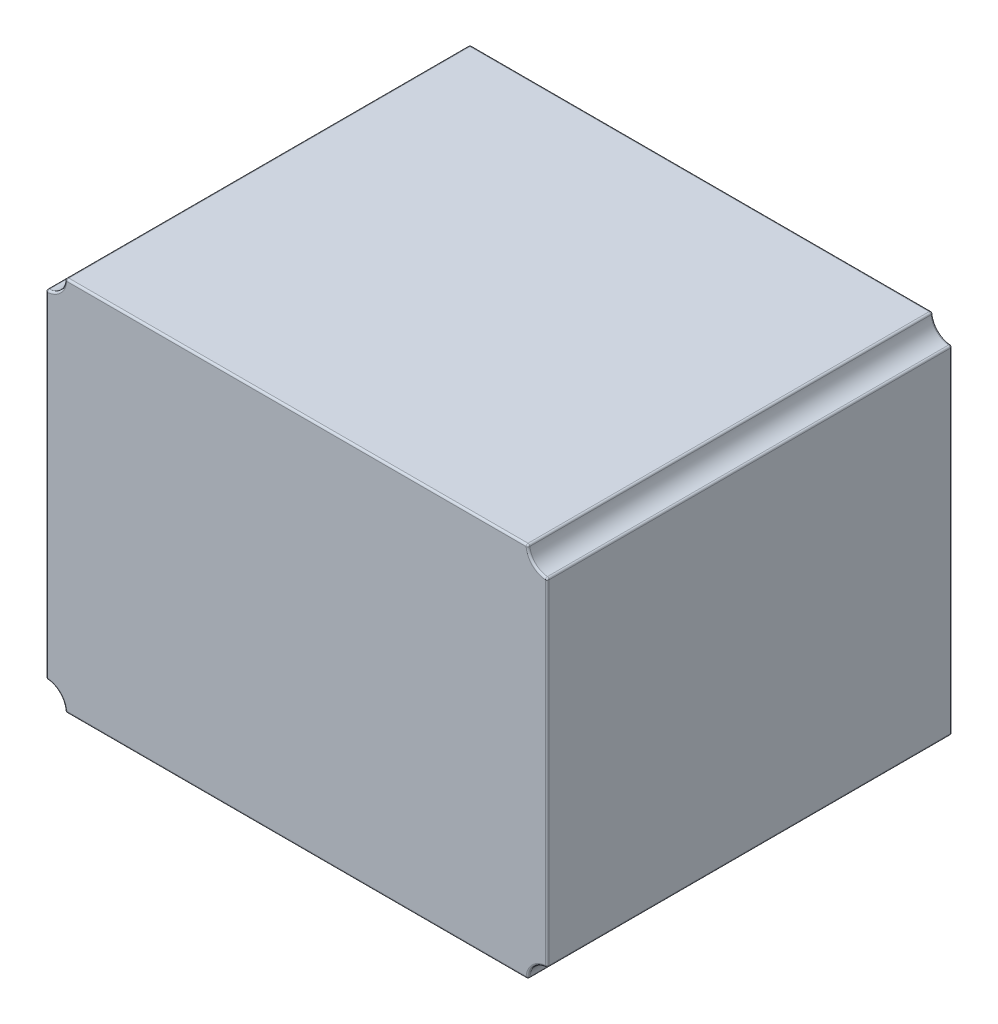
from build123d import *

# Parameters (mm, degrees)
SKETCH1_W           = 260
SKETCH1_H           = 195
BOSS_EXTRUDE1_DEPTH = 210
SKETCH2_R           = 10
CUT_EXTRUDE1_DEPTH  = 210
FILLET1_R           = 1
SKETCH4_W           = 19.05
SKETCH4_H           = 1.709615385
CUT_EXTRUDE2_DEPTH  = 60


with BuildPart() as part:
    # Sketch1 → Boss-Extrude1 (new body)
    with BuildSketch(Plane.XY):
        with Locations((130, -97.5)):
            Rectangle(SKETCH1_W, SKETCH1_H)
    extrude(amount=-BOSS_EXTRUDE1_DEPTH)

    # Sketch2 → Cut-Extrude1 (cut)
    with BuildSketch(Plane.XY):
        Circle(SKETCH2_R)
        with Locations((260, 0)):
            Circle(SKETCH2_R)
        with Locations((0, -195)):
            Circle(SKETCH2_R)
        with Locations((260, -195)):
            Circle(SKETCH2_R)
    extrude(amount=-CUT_EXTRUDE1_DEPTH, mode=Mode.SUBTRACT)

    # Fillet1
    fillet1_edges = [part.edges().sort_by_distance(p)[0] for p in [
        (0, -97.5, 0),
        (130, -195, 0),
        (260, -97.5, 0),
        (130, 0, 0),
        (7.071067812, -7.071067812, 0),
        (0, -97.5, -210),
        (130, 0, -210),
        (260, -97.5, -210),
        (130, -195, -210),
        (250, 0, -105),
        (260, -10, -105),
        (252.928932188, -7.071067812, -210),
        (252.928932188, -7.071067812, 0),
        (0, -185, -105),
        (10, -195, -105),
        (7.071067812, -187.928932188, -210),
        (7.071067812, -187.928932188, 0),
        (260, -185, -105),
        (250, -195, -105),
        (252.928932188, -187.928932188, -210),
        (252.928932188, -187.928932188, 0),
        (0, -10, -105),
        (10, 0, -105),
        (7.071067812, -7.071067812, -210),
    ]]
    fillet(fillet1_edges, radius=FILLET1_R)

    # Sketch4 → Cut-Extrude2 (cut)
    # profile 1 of 15: a face of its own
    with BuildSketch(Plane.ZY):
        Polygon((-47.45, -143.5375), (-66.5, -152.329807692), (-66.5, -150.471364183), (-60.394230769, -147.655078125), (-60.394230769, -139.019230769), (-66.5, -136.12280649), (-66.5, -134.256730769), (-47.45, -143.293269231), align=None)
        Polygon((-51.163070913, -143.396304087), (-58.440384615, -139.946544471), (-58.440384615, -146.754477163), align=None, mode=Mode.SUBTRACT)
    # profile 2 of 15: a face of its own
    with BuildSketch(Plane.ZY):
        with BuildLine():
            Line((-47.45, -119.602884615), (-47.45, -123.415174279))
            add(Edge.make_bspline(
                [(-47.45, -123.415174279), (-47.450846832, -123.669579564), (-47.452472844, -124.158065893), (-47.461539354, -124.857871836), (-47.48752549, -125.493745035), (-47.509887923, -126.065353018), (-47.550665489, -126.572685297), (-47.589639868, -127.017297551), (-47.640659365, -127.397142019), (-47.688041738, -127.627080152), (-47.709495192, -127.731189904)],
                knots=[0, 0, 0, 0, 1.410062039, 2.707475311, 3.878576406, 4.937260626, 5.877586885, 6.699081471, 7.410979367, 8, 8, 8, 8], degree=3))
            add(Edge.make_bspline(
                [(-47.709495192, -127.731189904), (-47.743926966, -127.870565556), (-47.81205599, -128.146343599), (-47.956128492, -128.543364771), (-48.122577642, -128.921852704), (-48.31959578, -129.280387043), (-48.543746484, -129.619001049), (-48.796339384, -129.937187723), (-49.078660841, -130.233127902), (-49.383501552, -130.509098702), (-49.713521346, -130.759257351), (-50.063912726, -130.975736931), (-50.432484202, -131.161107308), (-50.820519274, -131.309094055), (-51.224737745, -131.428144856), (-51.648669202, -131.512115361), (-52.090418491, -131.562466128), (-52.391723447, -131.567592807), (-52.544501202, -131.570192308)],
                knots=[0, 0, 0, 0, 1.02737288, 2.032829108, 3.019628684, 3.985738875, 4.958353778, 5.924249254, 6.890702889, 7.883913451, 8.865824512, 9.85161466, 10.829249435, 11.81541824, 12.821369441, 13.843154991, 14.906364023, 16, 16, 16, 16], degree=3))
            add(Edge.make_bspline(
                [(-52.544501202, -131.570192308), (-52.798329706, -131.562196968), (-53.293614861, -131.54659599), (-54.012399293, -131.401132171), (-54.682916054, -131.162873427), (-55.304232016, -130.834503333), (-55.864563384, -130.416530419), (-56.3550561, -129.914222021), (-56.769299546, -129.330143394), (-57.05350706, -128.78385169), (-57.236378356, -128.301057285), (-57.365693198, -127.902424225), (-57.463920314, -127.467252752), (-57.553195038, -127.001786063), (-57.621318824, -126.502428846), (-57.66969966, -125.970186684), (-57.700808906, -125.403728409), (-57.705354099, -125.015436277), (-57.707692308, -124.815685096)],
                knots=[0, 0, 0, 0, 1.260402266, 2.459371274, 3.627181936, 4.786749125, 5.93865593, 7.087644312, 8.261344208, 9.485713728, 10.136162886, 10.825977872, 11.566646758, 12.35154167, 13.181268117, 14.0701832, 15.007234106, 16, 16, 16, 16], degree=3))
            Line((-57.707692308, -124.815685096), (-66.5, -131.814423077))
            Line((-66.5, -131.814423077), (-66.5, -129.700300481))
            Line((-66.5, -129.700300481), (-57.707692308, -122.7015625))
            Line((-57.707692308, -122.7015625), (-57.707692308, -121.3125))
            Line((-57.707692308, -121.3125), (-66.5, -121.3125))
            Line((-66.5, -121.3125), (-66.5, -119.602884615))
            Line((-66.5, -119.602884615), (-47.45, -119.602884615))
        make_face()
        with BuildLine():
            Line((-49.403846154, -121.3125), (-55.753846154, -121.3125))
            Line((-55.753846154, -121.3125), (-55.780558894, -124.800420673))
            add(Edge.make_bspline(
                [(-55.780558894, -124.800420673), (-55.780630939, -124.96327117), (-55.780770582, -125.278921815), (-55.759033036, -125.735581157), (-55.734304379, -126.160777734), (-55.696480164, -126.55288536), (-55.647733283, -126.912078621), (-55.586757897, -127.238179886), (-55.515714591, -127.531715263), (-55.405771799, -127.874078333), (-55.231488036, -128.256262239), (-54.978350799, -128.672129417), (-54.657899182, -129.025072431), (-54.29729158, -129.329377718), (-53.892656588, -129.563770292), (-53.461954432, -129.734366963), (-53.008903502, -129.84142588), (-52.697725324, -129.854153673), (-52.540685096, -129.860576923)],
                knots=[0, 0, 0, 0, 1.14660753, 2.222451964, 3.218720504, 4.145691244, 4.995719623, 5.770487122, 6.480909919, 7.121111896, 8.299844659, 9.430703709, 10.534634535, 11.641396424, 12.741395289, 13.810956493, 14.895269934, 16, 16, 16, 16], degree=3))
            add(Edge.make_bspline(
                [(-52.540685096, -129.860576923), (-52.387444832, -129.854133928), (-52.083778546, -129.841366263), (-51.640439127, -129.734159532), (-51.219015781, -129.561036336), (-50.827541117, -129.318277549), (-50.46922699, -129.024940788), (-50.16688217, -128.676559766), (-49.913686005, -128.290679379), (-49.753066509, -127.929762313), (-49.654395403, -127.60739192), (-49.585047067, -127.327454312), (-49.528861277, -127.009946492), (-49.485177886, -126.655629383), (-49.445867827, -126.265144002), (-49.420380226, -125.837421125), (-49.404975515, -125.372954677), (-49.404231369, -125.051025014), (-49.403846154, -124.884375)],
                knots=[0, 0, 0, 0, 1.100801541, 2.181386982, 3.260112282, 4.364594493, 5.481957178, 6.577424609, 7.668452592, 8.790448866, 9.403819393, 10.091598921, 10.863153553, 11.720938239, 12.658472417, 13.685008818, 14.801622349, 16, 16, 16, 16], degree=3))
            Line((-49.403846154, -124.884375), (-49.403846154, -121.3125))
        make_face(mode=Mode.SUBTRACT)
    # profile 3 of 15: a face of its own
    with BuildSketch(Plane.ZY):
        Polygon((-47.45, -102.506730769), (-47.45, -104.464393029), (-55.635546875, -109.471123798), (-47.45, -114.470222356), (-47.45, -116.427884615), (-57.44438101, -110.322115385), (-66.5, -110.322115385), (-66.5, -108.6125), (-57.44438101, -108.6125), align=None)
    # profile 4 of 15: a face of its own
    with BuildSketch(Plane.ZY):
        Polygon((-47.45, -92.249038462), (-66.5, -101.041346154), (-66.5, -99.182902644), (-60.394230769, -96.366616587), (-60.394230769, -87.730769231), (-66.5, -84.834344952), (-66.5, -82.968269231), (-47.45, -92.004807692), align=None)
        Polygon((-51.163070913, -92.107842548), (-58.440384615, -88.658082933), (-58.440384615, -95.466015625), align=None, mode=Mode.SUBTRACT)
    # profile 5 of 15: a face of its own
    with BuildSketch(Plane.ZY):
        Polygon((-49.403846154, -70.756730769), (-47.45, -70.756730769), (-47.45, -80.770192308), (-64.546153846, -72.779266827), (-64.546153846, -80.525961538), (-66.5, -80.525961538), (-66.5, -70.024038462), (-49.403846154, -78.014963942), align=None)
    # profile 6 of 15: a face of its own
    with BuildSketch(Plane.ZY):
        Polygon((-49.403846154, -58.056730769), (-47.45, -58.056730769), (-47.45, -68.070192308), (-64.546153846, -60.079266827), (-64.546153846, -67.825961538), (-66.5, -67.825961538), (-66.5, -57.324038462), (-49.403846154, -65.314963942), align=None)
    # profile 7 of 15: a face of its own
    with BuildSketch(Plane.ZY):
        Polygon((-47.45, -44.868269231), (-47.45, -55.614423077), (-49.403846154, -55.614423077), (-49.403846154, -46.577884615), (-55.265384615, -46.577884615), (-55.265384615, -55.614423077), (-57.219230769, -55.614423077), (-57.219230769, -46.577884615), (-64.546153846, -46.577884615), (-64.546153846, -55.614423077), (-66.5, -55.614423077), (-66.5, -44.868269231), align=None)
    # profile 8 of 15: a face of its own
    with BuildSketch(Plane.ZY):
        Polygon((-80.932692308, -142.926923077), (-80.932692308, -144.636538462), (-88.748076923, -144.636538462), (-88.748076923, -154.405769231), (-80.932692308, -154.405769231), (-80.932692308, -156.115384615), (-99.982692308, -156.115384615), (-99.982692308, -154.405769231), (-90.701923077, -154.405769231), (-90.701923077, -144.636538462), (-99.982692308, -144.636538462), (-99.982692308, -142.926923077), align=None)
    # profile 9 of 15: a face of its own
    with BuildSketch(Plane.ZY):
        with BuildLine():
            Line((-84.428245192, -139.019230769), (-85.573076923, -137.523317308))
            add(Edge.make_bspline(
                [(-85.573076923, -137.523317308), (-85.445899287, -137.416605258), (-85.193258646, -137.204619869), (-84.838495697, -136.863574781), (-84.506126202, -136.508147268), (-84.194566829, -136.138473194), (-83.914712718, -135.747898557), (-83.651980001, -135.345884782), (-83.416479884, -134.92570685), (-83.130931346, -134.344672409), (-82.832955845, -133.58458912), (-82.583111115, -132.627762925), (-82.42406443, -131.628938231), (-82.40683865, -130.947505582), (-82.398076923, -130.600901442)],
                knots=[0, 0, 0, 0, 0.757959112, 1.505699292, 2.245454638, 2.979532153, 3.711538275, 4.438200793, 5.171680507, 5.909471876, 7.393775596, 8.890124382, 10.418191784, 12, 12, 12, 12], degree=3))
            add(Edge.make_bspline(
                [(-82.398076923, -130.600901442), (-82.400285554, -130.409950377), (-82.404682319, -130.029820452), (-82.462279857, -129.465642363), (-82.544166208, -128.910930677), (-82.662713702, -128.367748169), (-82.817051784, -127.837173354), (-82.998049158, -127.315166342), (-83.223282021, -126.807874985), (-83.472021648, -126.309194161), (-83.753051714, -125.831446514), (-84.059486008, -125.37931938), (-84.388316923, -124.954878316), (-84.738695649, -124.556947185), (-85.114976688, -124.18989016), (-85.512733539, -123.847824607), (-85.9367537, -123.536915352), (-86.379085031, -123.249522342), (-86.840377672, -122.993793964), (-87.317729707, -122.772960128), (-87.809316048, -122.58368717), (-88.31614374, -122.432531674), (-88.836218294, -122.313305891), (-89.370643424, -122.230939302), (-89.918381784, -122.173859906), (-90.289634835, -122.169503587), (-90.476772837, -122.167307692)],
                knots=[0, 0, 0, 0, 1.055000685, 2.100209969, 3.131349012, 4.153242145, 5.170189196, 6.184191144, 7.204341339, 8.235672124, 9.263040994, 10.265373269, 11.252624173, 12.22887325, 13.193405896, 14.155809299, 15.126090485, 16.097288279, 17.069732292, 18.038585918, 19.002221264, 19.978698174, 20.959418239, 21.948869816, 22.966084182, 24, 24, 24, 24], degree=3))
            add(Edge.make_bspline(
                [(-90.476772837, -122.167307692), (-90.758339021, -122.174175593), (-91.311156875, -122.187659805), (-92.120894056, -122.307665738), (-92.896613723, -122.490029163), (-93.633466865, -122.763345375), (-94.340539499, -123.100361921), (-95.005868116, -123.526214393), (-95.639506845, -124.01942726), (-96.226480604, -124.586978029), (-96.762676737, -125.209672542), (-97.234847759, -125.877771889), (-97.628447334, -126.589612084), (-97.955976414, -127.337333457), (-98.207745175, -128.126689877), (-98.384987047, -128.956261873), (-98.500605201, -129.824245161), (-98.511674275, -130.417350038), (-98.517307692, -130.719200721)],
                knots=[0, 0, 0, 0, 1.029171465, 2.020641659, 2.987623507, 3.938342917, 4.889210282, 5.84687017, 6.821220943, 7.821438502, 8.827599549, 9.822697543, 10.807740252, 11.797342354, 12.80366471, 13.83203677, 14.896651826, 16, 16, 16, 16], degree=3))
            add(Edge.make_bspline(
                [(-98.517307692, -130.719200721), (-98.508115905, -131.051773928), (-98.49002427, -131.706357558), (-98.3367575, -132.66630353), (-98.088247975, -133.585252483), (-97.740460712, -134.463253847), (-97.288348217, -135.297832421), (-96.740264056, -136.090294244), (-96.090994702, -136.841308221), (-95.595242246, -137.292909057), (-95.342307692, -137.523317308)],
                knots=[0, 0, 0, 0, 1.028121516, 2.023589091, 2.998037872, 3.967518031, 4.937445131, 5.927275754, 6.942489185, 8, 8, 8, 8], degree=3))
            Line((-95.342307692, -137.523317308), (-96.475691106, -139.019230769))
            add(Edge.make_bspline(
                [(-96.475691106, -139.019230769), (-96.631022088, -138.898845217), (-96.940940026, -138.658650752), (-97.377843537, -138.269712603), (-97.788815927, -137.859997881), (-98.170455818, -137.426410289), (-98.53073034, -136.974135537), (-98.857561576, -136.495207032), (-99.16090533, -135.9978968), (-99.43498821, -135.479309426), (-99.68073359, -134.941147501), (-99.888198634, -134.383971082), (-100.069484386, -133.812500599), (-100.217640148, -133.226448254), (-100.333462614, -132.62385621), (-100.410845371, -132.006791972), (-100.463872703, -131.373952986), (-100.468705026, -130.947007354), (-100.471153846, -130.730649038)],
                knots=[0, 0, 0, 0, 0.986756325, 1.968786143, 2.935506311, 3.899499537, 4.868307269, 5.8376204, 6.809456583, 7.792545619, 8.781780509, 9.778496008, 10.776623214, 11.79151764, 12.812666265, 13.856269958, 14.913646641, 16, 16, 16, 16], degree=3))
            add(Edge.make_bspline(
                [(-100.471153846, -130.730649038), (-100.469727858, -130.525759936), (-100.466908143, -130.120617109), (-100.421230775, -129.522453904), (-100.358911493, -128.9401249), (-100.265075922, -128.375294436), (-100.154344586, -127.8248802), (-100.005911032, -127.293871876), (-99.839636282, -126.777044231), (-99.644210568, -126.276473691), (-99.423686775, -125.791734468), (-99.174449861, -125.324390009), (-98.898595712, -124.874655255), (-98.60220487, -124.438108608), (-98.275756984, -124.021198902), (-97.923785731, -123.620313286), (-97.547477415, -123.233203808), (-97.27612457, -122.99370348), (-97.13969351, -122.87328726)],
                knots=[0, 0, 0, 0, 1.114604814, 2.203992996, 3.262667896, 4.300477797, 5.318619304, 6.316056647, 7.298880507, 8.271930387, 9.238335007, 10.195173496, 11.151986948, 12.108099108, 13.064862484, 14.031167946, 15.010108607, 16, 16, 16, 16], degree=3))
            add(Edge.make_bspline(
                [(-97.13969351, -122.87328726), (-96.902705039, -122.680416114), (-96.431589229, -122.297002333), (-95.668032674, -121.806461113), (-94.870827137, -121.386557991), (-94.035784382, -121.047054765), (-93.164778174, -120.781646174), (-92.257369446, -120.597779956), (-91.314405646, -120.478300508), (-90.673036839, -120.464637365), (-90.34702524, -120.457692308)],
                knots=[0, 0, 0, 0, 0.994628077, 1.977248131, 2.950237994, 3.925870899, 4.908910175, 5.911660606, 6.938484602, 8, 8, 8, 8], degree=3))
            add(Edge.make_bspline(
                [(-90.34702524, -120.457692308), (-90.004382036, -120.466194864), (-89.330252924, -120.482923114), (-88.340678649, -120.623874147), (-87.393960774, -120.853369659), (-86.486456552, -121.169386508), (-85.623358379, -121.586297226), (-84.801021026, -122.091001366), (-84.020115956, -122.688428669), (-83.290627113, -123.371076018), (-82.623680692, -124.119874819), (-82.036902279, -124.921699764), (-81.548583882, -125.775044223), (-81.140390155, -126.670490657), (-80.826639666, -127.614748637), (-80.607003011, -128.605802348), (-80.470294142, -129.641789885), (-80.453011938, -130.348612514), (-80.444230769, -130.707752404)],
                knots=[0, 0, 0, 0, 1.032901378, 2.032168977, 3.007206631, 3.966850309, 4.924221947, 5.891988639, 6.871730993, 7.884084801, 8.900290346, 9.89161143, 10.874607481, 11.860025555, 12.854717796, 13.869097222, 14.917278314, 16, 16, 16, 16], degree=3))
            add(Edge.make_bspline(
                [(-80.444230769, -130.707752404), (-80.446853018, -130.926634459), (-80.452043494, -131.359889443), (-80.502723922, -132.000794092), (-80.587057758, -132.624798754), (-80.702600815, -133.2334125), (-80.844217871, -133.828842286), (-81.029605542, -134.404979449), (-81.244886075, -134.964961272), (-81.486507596, -135.509207151), (-81.762736355, -136.031795854), (-82.062749743, -136.532632277), (-82.393473071, -137.005674746), (-82.743972617, -137.45982122), (-83.127359365, -137.884847426), (-83.531148028, -138.292892007), (-83.967320431, -138.669859565), (-84.274322355, -138.90256052), (-84.428245192, -139.019230769)],
                knots=[0, 0, 0, 0, 1.096705196, 2.170817488, 3.219277236, 4.250701065, 5.274195539, 6.284202015, 7.28098643, 8.279664616, 9.266225751, 10.241373748, 11.203306326, 12.157093976, 13.114198862, 14.069774147, 15.032234603, 16, 16, 16, 16], degree=3))
        make_face()
    # profile 10 of 15: a face of its own
    with BuildSketch(Plane.ZY):
        with Locations((-90.457692308, -116.427884616)):
            Rectangle(SKETCH4_W, SKETCH4_H)
    # profile 11 of 15: a face of its own
    with BuildSketch(Plane.ZY):
        Polygon((-80.932692308, -99.942307692), (-80.932692308, -101.651923077), (-88.187109375, -101.651923077), (-80.932692308, -109.593239183), (-80.932692308, -112.031730769), (-89.480769231, -102.670823317), (-99.982692308, -112.764423077), (-99.982692308, -110.486207933), (-90.78969351, -101.651923077), (-99.982692308, -101.651923077), (-99.982692308, -99.942307692), align=None)
    # profile 12 of 15: a face of its own
    with BuildSketch(Plane.ZY):
        Polygon((-80.932692308, -81.869230769), (-80.932692308, -83.578846154), (-88.748076923, -83.578846154), (-88.748076923, -93.348076923), (-80.932692308, -93.348076923), (-80.932692308, -95.057692308), (-99.982692308, -95.057692308), (-99.982692308, -93.348076923), (-90.701923077, -93.348076923), (-90.701923077, -83.578846154), (-99.982692308, -83.578846154), (-99.982692308, -81.869230769), align=None)
    # profile 13 of 15: a face of its own
    with BuildSketch(Plane.ZY):
        with BuildLine():
            Line((-84.428245192, -77.961538462), (-85.573076923, -76.465625))
            add(Edge.make_bspline(
                [(-85.573076923, -76.465625), (-85.445899287, -76.358912951), (-85.193258646, -76.146927561), (-84.838495697, -75.805882473), (-84.506126202, -75.45045496), (-84.194566829, -75.080780886), (-83.914712718, -74.69020625), (-83.651980001, -74.288192474), (-83.416479884, -73.868014542), (-83.130931346, -73.286980101), (-82.832955845, -72.526896812), (-82.583111115, -71.570070617), (-82.42406443, -70.571245924), (-82.40683865, -69.889813274), (-82.398076923, -69.543209135)],
                knots=[0, 0, 0, 0, 0.757959112, 1.505699292, 2.245454638, 2.979532153, 3.711538275, 4.438200793, 5.171680507, 5.909471876, 7.393775596, 8.890124382, 10.418191784, 12, 12, 12, 12], degree=3))
            add(Edge.make_bspline(
                [(-82.398076923, -69.543209135), (-82.400285554, -69.352258069), (-82.404682319, -68.972128145), (-82.462279857, -68.407950056), (-82.544166208, -67.853238369), (-82.662713702, -67.310055861), (-82.817051784, -66.779481046), (-82.998049158, -66.257474035), (-83.223282021, -65.750182678), (-83.472021648, -65.251501853), (-83.753051714, -64.773754206), (-84.059486008, -64.321627073), (-84.388316923, -63.897186009), (-84.738695649, -63.499254877), (-85.114976688, -63.132197853), (-85.512733539, -62.790132299), (-85.9367537, -62.479223044), (-86.379085031, -62.191830034), (-86.840377672, -61.936101657), (-87.317729707, -61.715267821), (-87.809316048, -61.525994862), (-88.31614374, -61.374839366), (-88.836218294, -61.255613583), (-89.370643424, -61.173246994), (-89.918381784, -61.116167598), (-90.289634835, -61.11181128), (-90.476772837, -61.109615385)],
                knots=[0, 0, 0, 0, 1.055000685, 2.100209969, 3.131349012, 4.153242145, 5.170189196, 6.184191144, 7.204341339, 8.235672124, 9.263040994, 10.265373269, 11.252624173, 12.22887325, 13.193405896, 14.155809299, 15.126090485, 16.097288279, 17.069732292, 18.038585918, 19.002221264, 19.978698174, 20.959418239, 21.948869816, 22.966084182, 24, 24, 24, 24], degree=3))
            add(Edge.make_bspline(
                [(-90.476772837, -61.109615385), (-90.758339021, -61.116483285), (-91.311156875, -61.129967497), (-92.120894056, -61.24997343), (-92.896613723, -61.432336855), (-93.633466865, -61.705653067), (-94.340539499, -62.042669614), (-95.005868116, -62.468522085), (-95.639506845, -62.961734952), (-96.226480604, -63.529285721), (-96.762676737, -64.151980234), (-97.234847759, -64.820079581), (-97.628447334, -65.531919776), (-97.955976414, -66.279641149), (-98.207745175, -67.068997569), (-98.384987047, -67.898569565), (-98.500605201, -68.766552854), (-98.511674275, -69.35965773), (-98.517307692, -69.661508413)],
                knots=[0, 0, 0, 0, 1.029171465, 2.020641659, 2.987623507, 3.938342917, 4.889210282, 5.84687017, 6.821220943, 7.821438502, 8.827599549, 9.822697543, 10.807740252, 11.797342354, 12.80366471, 13.83203677, 14.896651826, 16, 16, 16, 16], degree=3))
            add(Edge.make_bspline(
                [(-98.517307692, -69.661508413), (-98.508115905, -69.994081621), (-98.49002427, -70.648665251), (-98.3367575, -71.608611223), (-98.088247975, -72.527560176), (-97.740460712, -73.405561539), (-97.288348217, -74.240140114), (-96.740264056, -75.032601936), (-96.090994702, -75.783615913), (-95.595242246, -76.235216749), (-95.342307692, -76.465625)],
                knots=[0, 0, 0, 0, 1.028121516, 2.023589091, 2.998037872, 3.967518031, 4.937445131, 5.927275754, 6.942489185, 8, 8, 8, 8], degree=3))
            Line((-95.342307692, -76.465625), (-96.475691106, -77.961538462))
            add(Edge.make_bspline(
                [(-96.475691106, -77.961538462), (-96.631022088, -77.841152909), (-96.940940026, -77.600958444), (-97.377843537, -77.212020296), (-97.788815927, -76.802305574), (-98.170455818, -76.368717981), (-98.53073034, -75.916443229), (-98.857561576, -75.437514724), (-99.16090533, -74.940204492), (-99.43498821, -74.421617118), (-99.68073359, -73.883455194), (-99.888198634, -73.326278775), (-100.069484386, -72.754808291), (-100.217640148, -72.168755946), (-100.333462614, -71.566163902), (-100.410845371, -70.949099665), (-100.463872703, -70.316260678), (-100.468705026, -69.889315046), (-100.471153846, -69.672956731)],
                knots=[0, 0, 0, 0, 0.986756325, 1.968786143, 2.935506311, 3.899499537, 4.868307269, 5.8376204, 6.809456583, 7.792545619, 8.781780509, 9.778496008, 10.776623214, 11.79151764, 12.812666265, 13.856269958, 14.913646641, 16, 16, 16, 16], degree=3))
            add(Edge.make_bspline(
                [(-100.471153846, -69.672956731), (-100.469727858, -69.468067629), (-100.466908143, -69.062924801), (-100.421230775, -68.464761596), (-100.358911493, -67.882432592), (-100.265075922, -67.317602128), (-100.154344586, -66.767187893), (-100.005911032, -66.236179568), (-99.839636282, -65.719351923), (-99.644210568, -65.218781383), (-99.423686775, -64.73404216), (-99.174449861, -64.266697701), (-98.898595712, -63.816962948), (-98.60220487, -63.3804163), (-98.275756984, -62.963506594), (-97.923785731, -62.562620978), (-97.547477415, -62.1755115), (-97.27612457, -61.936011172), (-97.13969351, -61.815594952)],
                knots=[0, 0, 0, 0, 1.114604814, 2.203992996, 3.262667896, 4.300477797, 5.318619304, 6.316056647, 7.298880507, 8.271930387, 9.238335007, 10.195173496, 11.151986948, 12.108099108, 13.064862484, 14.031167946, 15.010108607, 16, 16, 16, 16], degree=3))
            add(Edge.make_bspline(
                [(-97.13969351, -61.815594952), (-96.902705039, -61.622723807), (-96.431589229, -61.239310026), (-95.668032674, -60.748768805), (-94.870827137, -60.328865683), (-94.035784382, -59.989362457), (-93.164778174, -59.723953867), (-92.257369446, -59.540087648), (-91.314405646, -59.420608201), (-90.673036839, -59.406945057), (-90.34702524, -59.4)],
                knots=[0, 0, 0, 0, 0.994628077, 1.977248131, 2.950237994, 3.925870899, 4.908910175, 5.911660606, 6.938484602, 8, 8, 8, 8], degree=3))
            add(Edge.make_bspline(
                [(-90.34702524, -59.4), (-90.004382036, -59.408502557), (-89.330252924, -59.425230806), (-88.340678649, -59.566181839), (-87.393960774, -59.795677351), (-86.486456552, -60.111694201), (-85.623358379, -60.528604918), (-84.801021026, -61.033309059), (-84.020115956, -61.630736361), (-83.290627113, -62.31338371), (-82.623680692, -63.062182511), (-82.036902279, -63.864007456), (-81.548583882, -64.717351915), (-81.140390155, -65.61279835), (-80.826639666, -66.557056329), (-80.607003011, -67.548110041), (-80.470294142, -68.584097577), (-80.453011938, -69.290920206), (-80.444230769, -69.650060096)],
                knots=[0, 0, 0, 0, 1.032901378, 2.032168977, 3.007206631, 3.966850309, 4.924221947, 5.891988639, 6.871730993, 7.884084801, 8.900290346, 9.89161143, 10.874607481, 11.860025555, 12.854717796, 13.869097222, 14.917278314, 16, 16, 16, 16], degree=3))
            add(Edge.make_bspline(
                [(-80.444230769, -69.650060096), (-80.446853018, -69.868942151), (-80.452043494, -70.302197135), (-80.502723922, -70.943101784), (-80.587057758, -71.567106447), (-80.702600815, -72.175720192), (-80.844217871, -72.771149978), (-81.029605542, -73.347287142), (-81.244886075, -73.907268965), (-81.486507596, -74.451514844), (-81.762736355, -74.974103546), (-82.062749743, -75.474939969), (-82.393473071, -75.947982438), (-82.743972617, -76.402128913), (-83.127359365, -76.827155118), (-83.531148028, -77.235199699), (-83.967320431, -77.612167257), (-84.274322355, -77.844868212), (-84.428245192, -77.961538462)],
                knots=[0, 0, 0, 0, 1.096705196, 2.170817488, 3.219277236, 4.250701065, 5.274195539, 6.284202015, 7.28098643, 8.279664616, 9.266225751, 10.241373748, 11.203306326, 12.157093976, 13.114198862, 14.069774147, 15.032234603, 16, 16, 16, 16], degree=3))
        make_face()
    # profile 14 of 15: a face of its own
    with BuildSketch(Plane.ZY):
        with Locations((-90.457692308, -55.370192308)):
            Rectangle(SKETCH4_W, SKETCH4_H)
    # profile 15 of 15: a face of its own
    with BuildSketch(Plane.ZY):
        Polygon((-80.932692308, -38.884615385), (-80.932692308, -40.594230769), (-88.187109375, -40.594230769), (-80.932692308, -48.535546875), (-80.932692308, -50.974038462), (-89.480769231, -41.61313101), (-99.982692308, -51.706730769), (-99.982692308, -49.428515625), (-90.78969351, -40.594230769), (-99.982692308, -40.594230769), (-99.982692308, -38.884615385), align=None)
    extrude(amount=-CUT_EXTRUDE2_DEPTH, mode=Mode.SUBTRACT)


solid = part.part
